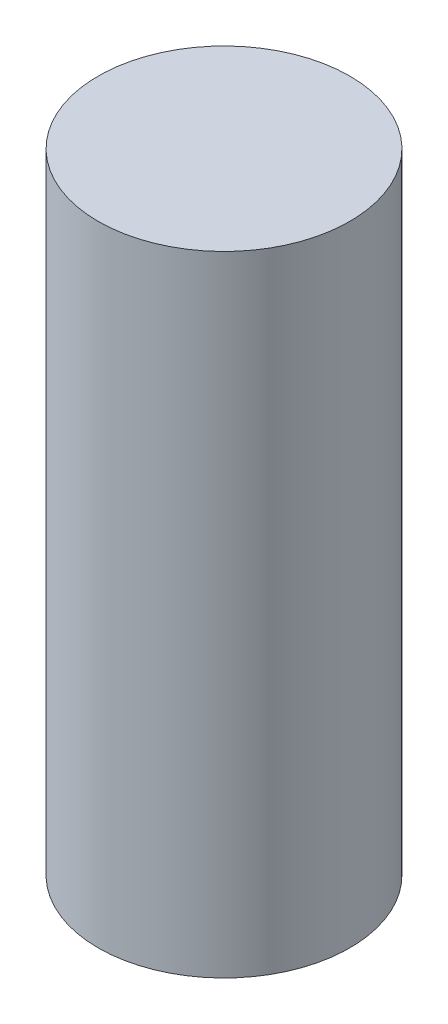
from build123d import *

# Parameters (mm, degrees)
SZKIC1_R                    = 40
DODANIE_WYCI_GNI_CIE1_DEPTH = 200


with BuildPart() as part:
    # Szkic1 → Dodanie-wyciągnięcie1 (new body)
    with BuildSketch(Plane(origin=(0, 0, 0), x_dir=(1, 0, 0), z_dir=(0, 1, 0))):
        with Locations(Location((0, 0, 0), (0, 0, 270))):
            Circle(SZKIC1_R)
    extrude(amount=DODANIE_WYCI_GNI_CIE1_DEPTH)


solid = part.part
